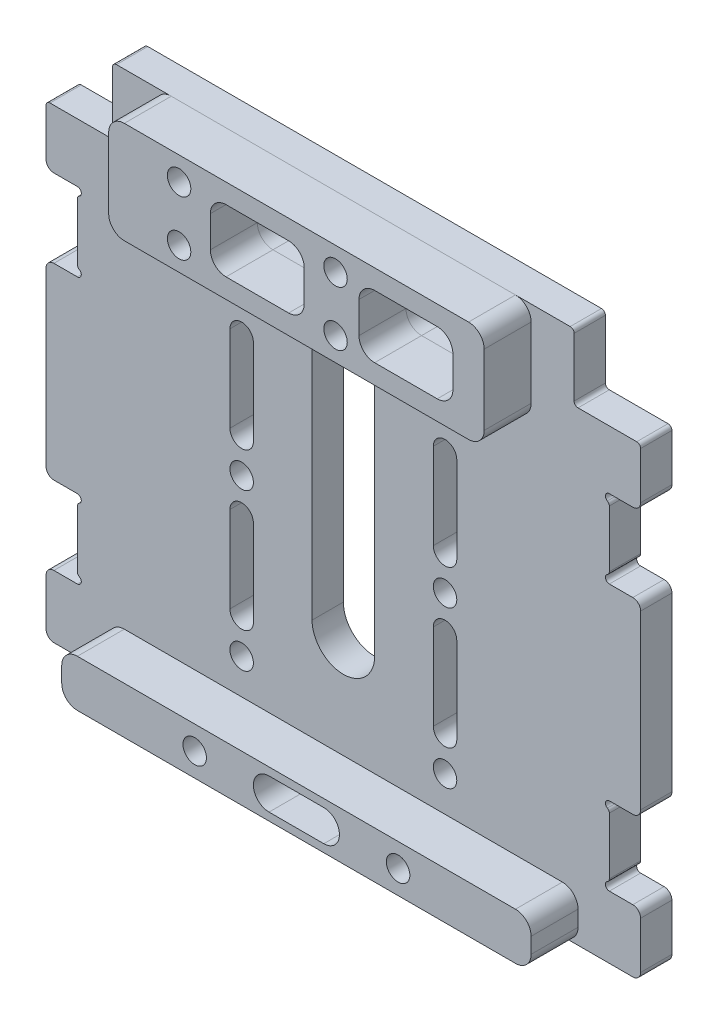
from build123d import *

# Parameters (mm, degrees)
EXTRUDE_1_DEPTH      = 4
SKETCH_3_R           = 1.5
CUT_EXTRUDE_2_DEPTH  = 4
SKETCH_4_W           = 48
SKETCH_4_H           = 13
EXTRUDE_2_DEPTH      = 6
CUT_EXTRUDE_START    = -10
SKETCH_5_R           = 1.5
CUT_EXTRUDE_3_DEPTH  = 10
SKETCH_6_W           = 60
SKETCH_6_H           = 6
EXTRUDE_3_DEPTH      = 6
SKETCH_7_R           = 1.5
CUT_EXTRUDE_4_DEPTH  = 10
SKETCH_8_W           = 12
SKETCH_8_H           = 8
CUT_EXTRUDE_5_DEPTH  = 10
CUT_EXTRUDE_6_DEPTH  = 10
FILLET_1_R           = 2
FILLET_2_R           = 2
CUT_EXTRUDE_7_DEPTH  = 4
CUT_EXTRUDE_8_DEPTH  = 4
CUT_EXTRUDE_9_DEPTH  = 4
FILLET_3_R           = 0.5
FILLET_4_R           = 2
FILLET_5_R           = 1
SKETCH_13_W          = 8.5
SKETCH_13_H          = 8.5
CUT_EXTRUDE_10_DEPTH = 4
FILLET_6_R           = 0.5


with BuildPart() as part:
    # 草图1 → 凸台-拉伸1 (new body)
    with BuildSketch(Plane.XY):
        Polygon((-38, -26), (-38, -34), (38, -34), (-38, 34), (-38, 18), (-34, 18), (-34, 8), (-38, 8), (-38, -16), (-34, -16), (-34, -26), align=None)
        Polygon((-38, 34), (38, -34), (38, -26), (34, -26), (34, -16), (38, -16), (38, 8), (34, 8), (34, 18), (38, 18), (38, 34), align=None)
    extrude(amount=EXTRUDE_1_DEPTH)

    # 草图3 → 切除-拉伸2 (cut)
    with BuildSketch(Plane.XY.offset(4)):
        with Locations((13, 16.5)):
            Circle(SKETCH_3_R)
        with Locations((13, -3.5)):
            Circle(SKETCH_3_R)
        with Locations((13, -23.5)):
            Circle(SKETCH_3_R)
        with Locations((-13, -23.5)):
            Circle(SKETCH_3_R)
        with Locations((-13, -3.5)):
            Circle(SKETCH_3_R)
        with Locations((-13, 16.5)):
            Circle(SKETCH_3_R)
    extrude(amount=-CUT_EXTRUDE_2_DEPTH, mode=Mode.SUBTRACT)


with BuildPart() as body_2:
    # 草图4 → 凸台-拉伸2 (new body)
    with BuildSketch(Plane.XY.offset(4)):
        with Locations((0, 27.5)):
            Rectangle(SKETCH_4_W, SKETCH_4_H)
    extrude(amount=EXTRUDE_2_DEPTH)


with BuildPart() as cut_extrude_3_tool:
    # 草图5 → 切除-拉伸3 (new body)
    with BuildSketch(Plane.XY.offset(10).offset(CUT_EXTRUDE_START)):
        with Locations((5, 31)):
            Circle(SKETCH_5_R)
        with Locations((5, 24)):
            Circle(SKETCH_5_R)
        with Locations((-15, 24)):
            Circle(SKETCH_5_R)
        with Locations((-15, 31)):
            Circle(SKETCH_5_R)
    extrude(amount=CUT_EXTRUDE_3_DEPTH)


with BuildPart() as part_1:
    add(part.part)

    # 切除-拉伸3: cut by cut_extrude_3_tool
    add(cut_extrude_3_tool.part, mode=Mode.SUBTRACT)


with BuildPart() as body_2_1:
    add(body_2.part)

    # 切除-拉伸3: cut by cut_extrude_3_tool
    add(cut_extrude_3_tool.part, mode=Mode.SUBTRACT)


with BuildPart() as body_3:
    # 草图6 → 凸台-拉伸3 (new body)
    with BuildSketch(Plane.XY.offset(4)):
        with Locations((0, -31)):
            Rectangle(SKETCH_6_W, SKETCH_6_H)
    extrude(amount=EXTRUDE_3_DEPTH)


with BuildPart() as cut_extrude_4_tool:
    # 草图7 → 切除-拉伸4 (new body)
    with BuildSketch(Plane.XY.offset(10).offset(CUT_EXTRUDE_START)):
        with Locations((-13, -31)):
            Circle(SKETCH_7_R)
        with Locations((13, -31)):
            Circle(SKETCH_7_R)
        with Locations((-3, -31)):
            Circle(SKETCH_7_R)
        with Locations((3, -31)):
            Circle(SKETCH_7_R)
    extrude(amount=CUT_EXTRUDE_4_DEPTH)


with BuildPart() as part_2:
    add(part_1.part)

    # 切除-拉伸4: cut by cut_extrude_4_tool
    add(cut_extrude_4_tool.part, mode=Mode.SUBTRACT)


with BuildPart() as body_3_1:
    add(body_3.part)

    # 切除-拉伸4: cut by cut_extrude_4_tool
    add(cut_extrude_4_tool.part, mode=Mode.SUBTRACT)


with BuildPart() as cut_extrude_5_tool:
    # 草图8 → 切除-拉伸5 (new body)
    with BuildSketch(Plane.XY.offset(10).offset(CUT_EXTRUDE_START)):
        with Locations((-5, 27.5)):
            Rectangle(SKETCH_8_W, SKETCH_8_H)
        with Locations((14, 27.5)):
            Rectangle(SKETCH_8_W, SKETCH_8_H)
    extrude(amount=CUT_EXTRUDE_5_DEPTH)


with BuildPart() as part_3:
    add(part_2.part)

    # 切除-拉伸5: cut by cut_extrude_5_tool
    add(cut_extrude_5_tool.part, mode=Mode.SUBTRACT)


with BuildPart() as body_2_2:
    add(body_2_1.part)

    # 切除-拉伸5: cut by cut_extrude_5_tool
    add(cut_extrude_5_tool.part, mode=Mode.SUBTRACT)

    # 圆角2
    fillet_2_edges = [body_2_2.edges().sort_by_distance(p)[0] for p in [
        (1, 31.5, 7),
        (1, 23.5, 7),
        (-11, 23.5, 7),
        (-11, 31.5, 7),
        (20, 31.5, 7),
        (20, 23.5, 7),
        (8, 23.5, 7),
        (8, 31.5, 7),
        (24, 21, 7),
        (-24, 21, 7),
        (-24, 34, 7),
        (24, 34, 7),
    ]]
    fillet(fillet_2_edges, radius=FILLET_2_R)


with BuildPart() as cut_extrude_6_tool:
    # 草图9 → 切除-拉伸6 (new body)
    with BuildSketch(Plane.XY.offset(10).offset(CUT_EXTRUDE_START)):
        with BuildLine():
            Line((-3.5, -29), (3.5, -29))
            ThreePointArc((3.5, -29), (5.5, -31), (3.5, -33))
            Line((3.5, -33), (-3.5, -33))
            ThreePointArc((-3.5, -33), (-5.5, -31), (-3.5, -29))
        make_face()
    extrude(amount=CUT_EXTRUDE_6_DEPTH)


with BuildPart() as part_4:
    add(part_3.part)

    # 切除-拉伸6: cut by cut_extrude_6_tool
    add(cut_extrude_6_tool.part, mode=Mode.SUBTRACT)

    # 草图10 → 切除-拉伸7 (cut)
    with BuildSketch(Plane.XY.offset(4)):
        with BuildLine():
            ThreePointArc((34, -25), (33.5, -25.5), (34, -26))
            Line((34, -26), (34, -25))
        make_face()
        with BuildLine():
            ThreePointArc((34, -16), (33.5, -16.5), (34, -17))
            Line((34, -17), (34, -16))
        make_face()
        with BuildLine():
            ThreePointArc((34, 9), (33.5, 8.5), (34, 8))
            Line((34, 8), (34, 9))
        make_face()
        with BuildLine():
            ThreePointArc((34, 18), (33.5, 17.5), (34, 17))
            Line((34, 17), (34, 18))
        make_face()
        with BuildLine():
            Line((-34, 18), (-34, 17))
            ThreePointArc((-34, 17), (-33.5, 17.5), (-34, 18))
        make_face()
        with BuildLine():
            Line((-34, 9), (-34, 8))
            ThreePointArc((-34, 8), (-33.5, 8.5), (-34, 9))
        make_face()
        with BuildLine():
            Line((-34, -25), (-34, -26))
            ThreePointArc((-34, -26), (-33.5, -25.5), (-34, -25))
        make_face()
        with BuildLine():
            Line((-34, -16), (-34, -17))
            ThreePointArc((-34, -17), (-33.5, -16.5), (-34, -16))
        make_face()
    extrude(amount=-CUT_EXTRUDE_7_DEPTH, mode=Mode.SUBTRACT)

    # 草图11 → 切除-拉伸8 (cut)
    with BuildSketch(Plane.XY.offset(4)):
        with BuildLine():
            Line((-14.5, 12), (-14.5, 1))
            ThreePointArc((-14.5, 1), (-13, -0.5), (-11.5, 1))
            Line((-11.5, 1), (-11.5, 12))
            ThreePointArc((-11.5, 12), (-13, 13.5), (-14.5, 12))
        make_face()
        with BuildLine():
            ThreePointArc((14.5, 1), (13, -0.5), (11.5, 1))
            Line((11.5, 1), (11.5, 12))
            ThreePointArc((11.5, 12), (13, 13.5), (14.5, 12))
            Line((14.5, 12), (14.5, 1))
        make_face()
        with BuildLine():
            Line((14.5, -19), (14.5, -8))
            ThreePointArc((14.5, -8), (13, -6.5), (11.5, -8))
            Line((11.5, -8), (11.5, -19))
            ThreePointArc((11.5, -19), (13, -20.5), (14.5, -19))
        make_face()
        with BuildLine():
            ThreePointArc((-14.5, -8), (-13, -6.5), (-11.5, -8))
            Line((-11.5, -8), (-11.5, -19))
            ThreePointArc((-11.5, -19), (-13, -20.5), (-14.5, -19))
            Line((-14.5, -19), (-14.5, -8))
        make_face()
    extrude(amount=-CUT_EXTRUDE_8_DEPTH, mode=Mode.SUBTRACT)

    # 草图12 → 切除-拉伸9 (cut)
    with BuildSketch(Plane.XY.offset(4)):
        with BuildLine():
            Line((4, 15), (4, -15))
            ThreePointArc((4, -15), (0, -19), (-4, -15))
            Line((-4, -15), (-4, 15))
            ThreePointArc((-4, 15), (0, 19), (4, 15))
        make_face()
    extrude(amount=-CUT_EXTRUDE_9_DEPTH, mode=Mode.SUBTRACT)

    # 圆角3
    fillet_3_edges = [part_4.edges().sort_by_distance(p)[0] for p in [
        (34, -17, 2),
        (34, 9, 2),
        (34, 17, 2),
        (-34, 17, 2),
        (-34, -17, 2),
        (-34, -25, 2),
        (-34, 9, 2),
        (34, -25, 2),
    ]]
    fillet(fillet_3_edges, radius=FILLET_3_R)

    # 圆角4
    fillet_4_edges = [part_4.edges().sort_by_distance(p)[0] for p in [
        (1, 31.5, 2),
        (1, 23.5, 2),
        (-11, 23.5, 2),
        (-11, 31.5, 2),
        (20, 31.5, 2),
        (20, 23.5, 2),
        (8, 23.5, 2),
        (8, 31.5, 2),
    ]]
    fillet(fillet_4_edges, radius=FILLET_4_R)

    # 圆角5
    fillet_5_edges = [part_4.edges().sort_by_distance(p)[0] for p in [
        (-38, -16, 2),
        (-38, 8, 2),
        (-38, 18, 2),
        (-38, 34, 2),
        (38, 34, 2),
        (38, 18, 2),
        (38, 8, 2),
        (38, -16, 2),
        (38, -26, 2),
        (38, -34, 2),
        (-38, -34, 2),
        (-38, -26, 2),
    ]]
    fillet(fillet_5_edges, radius=FILLET_5_R)

    # 草图13 → 切除-拉伸10 (cut)
    with BuildSketch(Plane.XY.offset(4)):
        with Locations((-33.75, 29.75)):
            Rectangle(SKETCH_13_W, SKETCH_13_H)
        with Locations((33.75, 29.75)):
            Rectangle(SKETCH_13_W, SKETCH_13_H)
    extrude(amount=-CUT_EXTRUDE_10_DEPTH, mode=Mode.SUBTRACT)

    # 圆角6
    fillet_6_edges = [part_4.edges().sort_by_distance(p)[0] for p in [
        (-38, 25.5, 2),
        (-29.5, 34, 2),
        (-29.5, 25.5, 2),
        (29.5, 34, 2),
        (38, 25.5, 2),
        (29.5, 25.5, 2),
    ]]
    fillet(fillet_6_edges, radius=FILLET_6_R)


with BuildPart() as body_3_2:
    add(body_3_1.part)

    # 切除-拉伸6: cut by cut_extrude_6_tool
    add(cut_extrude_6_tool.part, mode=Mode.SUBTRACT)

    # 圆角1
    fillet_1_edges = [body_3_2.edges().sort_by_distance(p)[0] for p in [
        (30, -34, 7),
        (-30, -34, 7),
        (-30, -28, 7),
        (30, -28, 7),
    ]]
    fillet(fillet_1_edges, radius=FILLET_1_R)


solid = Compound([body_2_2.part, part_4.part, body_3_2.part])
